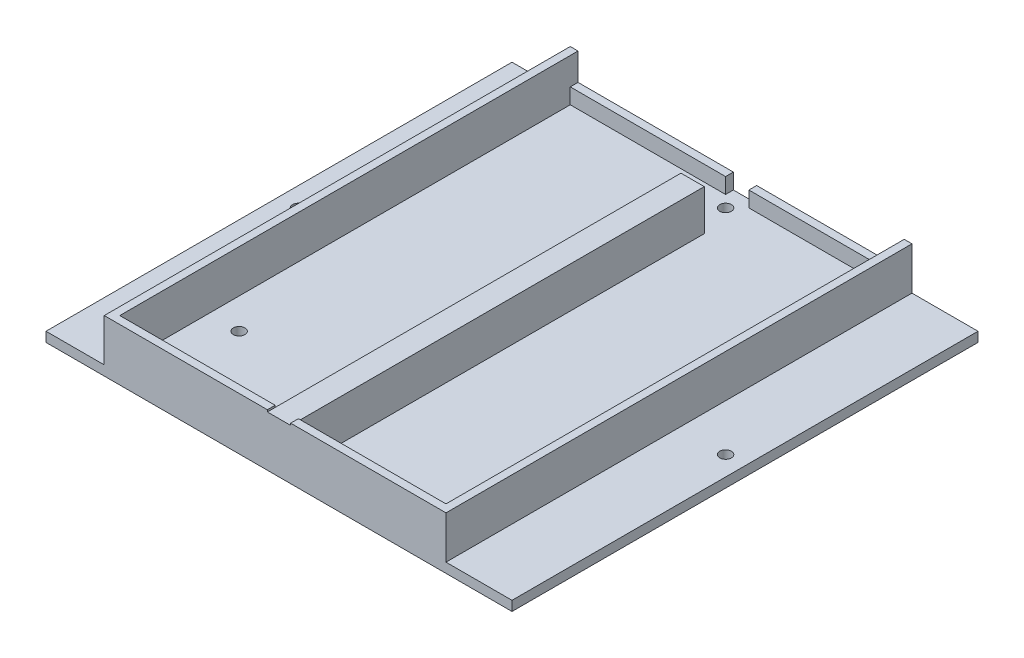
from build123d import *

# Parameters (mm, degrees)
BOSS_EXTRUDE3_DEPTH  = 2.5
BOSS_EXTRUDE4_DEPTH  = 2.5
BOSS_EXTRUDE5_DEPTH  = 10.5
BOSS_EXTRUDE8_DEPTH  = 11
BOSS_EXTRUDE9_DEPTH  = 11
SKETCH8_W            = 84
SKETCH8_H            = 2
BOSS_EXTRUDE11_DEPTH = 4
SKETCH9_W            = 6
SKETCH9_H            = 7.053661792
CUT_EXTRUDE1_DEPTH   = 28
SKETCH10_W           = 6
SKETCH10_H           = 6.438726715
CUT_EXTRUDE4_DEPTH   = 11
SKETCH11_R           = 1.5
CUT_EXTRUDE5_DEPTH   = 14
SKETCH13_R           = 1.5
CUT_EXTRUDE6_DEPTH   = 14
SKETCH15_R           = 1.5
CUT_EXTRUDE7_DEPTH   = 14


with BuildPart() as part:
    # Sketch1 → Boss-Extrude3 (new body)
    with BuildSketch(Plane(origin=(0, 0, 0), x_dir=(1, 0, 0), z_dir=(0, 1, 0))):
        with BuildLine():
            Line((-44.72135955, -40), (0, -40))
            Line((0, -40), (44.72135955, -40))
            ThreePointArc((44.72135955, -40), (56.050341538, -21.409325386), (60, 0))
            ThreePointArc((60, 0), (-21.409325386, 56.050341538), (-44.72135955, -40))
        make_face()
        with BuildLine():
            Line((-33.166247904, -50), (0, -50))
            Line((0, -50), (0, -40))
            Line((0, -40), (-44.72135955, -40))
            ThreePointArc((-44.72135955, -40), (-39.2634671, -45.369374597), (-33.166247904, -50))
        make_face()
        with BuildLine():
            Line((0, -40), (0, -50))
            Line((0, -50), (33.166247904, -50))
            ThreePointArc((33.166247904, -50), (39.2634671, -45.369374597), (44.72135955, -40))
            Line((44.72135955, -40), (0, -40))
        make_face()
        with BuildLine():
            Line((0, -50), (0, -60))
            add(Edge.make_bspline(
                [(0, -60), (2.493909774, -59.986931125), (4.933150425, -59.785698627)],
                knots=[0, 0, 0, 0.138485859, 0.138485859, 0.138485859], degree=2))
            add(Edge.make_bspline(
                [(4.933150425, -59.785698627), (12.350363719, -59.151298506), (19.667130305, -57.122142348), (26.368544437, -53.878843782)],
                knots=[0.549095967, 0.549095967, 0.549095967, 0.549095967, 0.769976712, 0.769976712, 0.769976712, 0.769976712], degree=3))
            add(Edge.make_bspline(
                [(26.368544437, -53.878843782), (29.836187059, -52.176190697), (33.166247904, -50)],
                knots=[0.7803077, 0.7803077, 0.7803077, 1, 1, 1], degree=2))
            Line((33.166247904, -50), (0, -50))
        make_face()
        with BuildLine():
            add(Edge.make_bspline(
                [(-9.467287752, -59.24160526), (-4.836502075, -59.974590334), (0, -60)],
                knots=[0.731444001, 0.731444001, 0.731444001, 1, 1, 1], degree=2))
            Line((0, -60), (0, -50))
            Line((0, -50), (-33.166247904, -50))
            add(Edge.make_bspline(
                [(-33.166247904, -50), (-28.091057223, -53.316740978), (-22.696065652, -55.533505256)],
                knots=[0, 0, 0, 0.334842238, 0.334842238, 0.334842238], degree=2))
            add(Edge.make_bspline(
                [(-22.696065652, -55.533505256), (-18.44552317, -57.261077796), (-13.998129322, -58.510750178), (-9.467287752, -59.24160526)],
                knots=[0.269647974, 0.269647974, 0.269647974, 0.269647974, 0.406041898, 0.406041898, 0.406041898, 0.406041898], degree=3))
        make_face()
    extrude(amount=BOSS_EXTRUDE3_DEPTH)

    # Sketch3 → Boss-Extrude4 (add)
    with BuildSketch(Plane(origin=(0, 2.5, 0), x_dir=(1, 0, 0), z_dir=(0, 1, 0))):
        Polygon((0, 60), (-60, 60), (-60, -60), (60, -60), (60, 60), align=None)
    extrude(amount=-BOSS_EXTRUDE4_DEPTH)

    # Sketch4 → Boss-Extrude5 (add)
    with BuildSketch(Plane(origin=(0, 2.5, 0), x_dir=(1, 0, 0), z_dir=(0, 1, 0))):
        Polygon((3, 60), (0, 60), (-3, 60), (-3, -60), (3, -60), align=None)
    extrude(amount=BOSS_EXTRUDE5_DEPTH)

    # Sketch5 → Boss-Extrude8 (add)
    with BuildSketch(Plane(origin=(0, 2.5, 0), x_dir=(1, 0, 0), z_dir=(0, 1, 0))):
        Polygon((-43, -60), (-3, -60), (-3, -58), (-43, -58), (-43, 60), (-45, 60), (-45, -58), (-45, -60), align=None)
    extrude(amount=BOSS_EXTRUDE8_DEPTH)

    # Sketch7 → Boss-Extrude9 (add)
    with BuildSketch(Plane(origin=(0, 2.5, 0), x_dir=(1, 0, 0), z_dir=(0, 1, 0))):
        Polygon((3, -60), (43, -60), (43, 60), (41, 60), (41, -58), (3, -58), align=None)
    extrude(amount=BOSS_EXTRUDE9_DEPTH)

    # Sketch8 → Boss-Extrude11 (add)
    with BuildSketch(Plane(origin=(0, 2.5, 0), x_dir=(1, 0, 0), z_dir=(0, 1, 0))):
        with Locations((-1, 59)):
            Rectangle(SKETCH8_W, SKETCH8_H)
    extrude(amount=BOSS_EXTRUDE11_DEPTH)

    # Sketch9 → Cut-Extrude1 (cut)
    with BuildSketch(Plane(origin=(0, 2.5, 0), x_dir=(1, 0, 0), z_dir=(0, 1, 0))):
        with Locations((0, 56.473169104)):
            Rectangle(SKETCH9_W, SKETCH9_H)
    extrude(amount=CUT_EXTRUDE1_DEPTH, mode=Mode.SUBTRACT)

    # Sketch10 → Cut-Extrude4 (cut)
    with BuildSketch(Plane(origin=(0, 2.5, 0), x_dir=(1, 0, 0), z_dir=(0, 1, 0))):
        with Locations((0, 49.72697485)):
            Rectangle(SKETCH10_W, SKETCH10_H)
    extrude(amount=CUT_EXTRUDE4_DEPTH, mode=Mode.SUBTRACT)

    # Sketch11 → Cut-Extrude5 (cut)
    with BuildSketch(Plane(origin=(0, 2.5, 0), x_dir=(1, 0, 0), z_dir=(0, 1, 0))):
        with Locations(Location((-35.129064889, -35.129064889, 0), (0, 0, 270))):
            Circle(SKETCH11_R)
        with Locations(Location((35.129064889, -35.129064889, 0), (0, 0, 270))):
            Circle(SKETCH11_R)
    extrude(amount=-CUT_EXTRUDE5_DEPTH, mode=Mode.SUBTRACT)

    # Sketch13 → Cut-Extrude6 (cut)
    with BuildSketch(Plane(origin=(0, 13, 0), x_dir=(1, 0, 0), z_dir=(0, 1, 0))):
        with Locations(Location((-55, 0, 0), (0, 0, 270))):
            Circle(SKETCH13_R)
        with Locations(Location((55, 0, 0), (0, 0, 270))):
            Circle(SKETCH13_R)
    extrude(amount=-CUT_EXTRUDE6_DEPTH, mode=Mode.SUBTRACT)

    # Sketch15 → Cut-Extrude7 (cut)
    with BuildSketch(Plane(origin=(0, 2.5, 0), x_dir=(1, 0, 0), z_dir=(0, 1, 0))):
        with Locations(Location((0, 55, 0), (0, 0, 270))):
            Circle(SKETCH15_R)
    extrude(amount=-CUT_EXTRUDE7_DEPTH, mode=Mode.SUBTRACT)


solid = part.part
